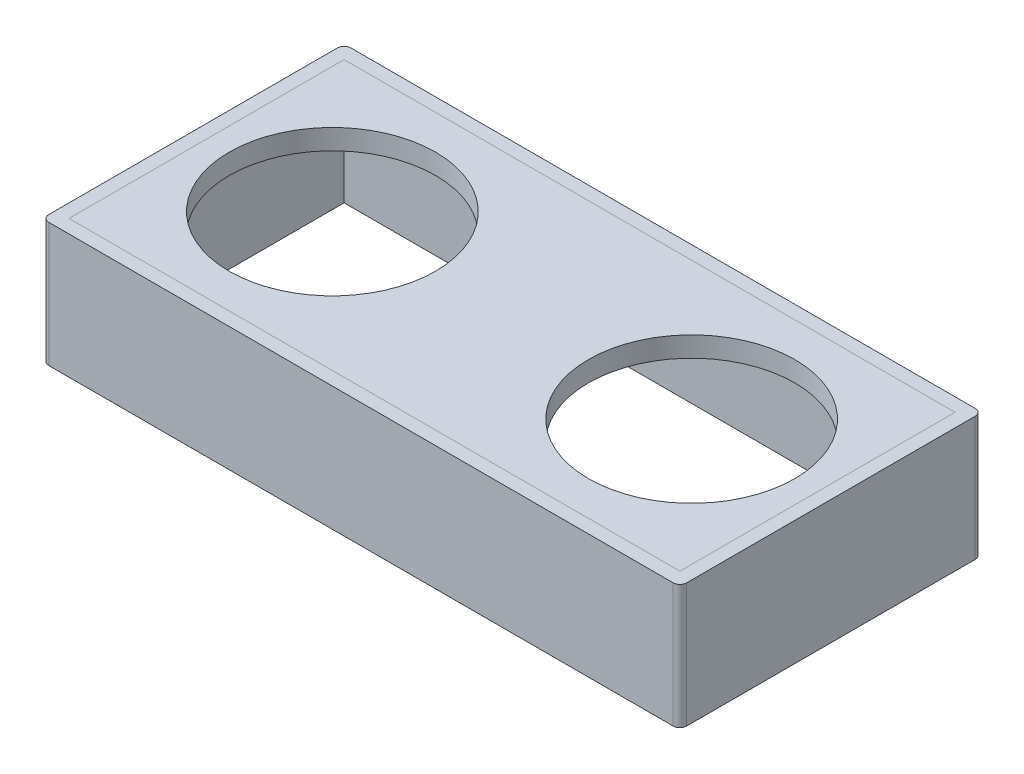
from build123d import *

# Parameters (mm, degrees)
CROQUIS2_W                   = 45.3
CROQUIS2_H                   = 20.4
CROQUIS2_R                   = 7.65
SALIENTE_EXTRUIR1_DEPTH      = 1.5
SALIENTE_EXTRUIR2_DEPTH      = 7.7
SALIENTE_EXTRUIR2_DEPTH_BACK = 1.5
CROQUIS3_W                   = 45.3
CROQUIS3_H                   = 20.4


with BuildPart() as part:
    # Croquis2 → Saliente-Extruir1 (new body)
    with BuildSketch(Plane(origin=(0, 0, 0), x_dir=(1, 0, 0), z_dir=(0, 1, 0))):
        with Locations((0.898083434, 0.47687702)):
            Rectangle(CROQUIS2_W, CROQUIS2_H)
        with Locations(Location((14.218083434, 0.47687702, 0), (0, 0, 270))):
            Circle(CROQUIS2_R, mode=Mode.SUBTRACT)
        with Locations(Location((-12.421916566, 0.47687702, 0), (0, 0, 270))):
            Circle(CROQUIS2_R, mode=Mode.SUBTRACT)
    extrude(amount=SALIENTE_EXTRUIR1_DEPTH)


with BuildPart() as body_2:
    # Croquis3 → Saliente-Extruir2 (new, two sides: drawn at the far end of the back side and taken through both)
    with BuildSketch(Plane.XZ.offset(-SALIENTE_EXTRUIR2_DEPTH_BACK)):
        with BuildLine():
            Line((-22.751916566, 10.22312298), (-22.751916566, -11.17687702))
            ThreePointArc((-22.751916566, -11.17687702), (-22.605469957, -11.530430411), (-22.251916566, -11.67687702))
            Line((-22.251916566, -11.67687702), (24.048083434, -11.67687702))
            ThreePointArc((24.048083434, -11.67687702), (24.401636824, -11.530430411), (24.548083434, -11.17687702))
            Line((24.548083434, -11.17687702), (24.548083434, 10.22312298))
            ThreePointArc((24.548083434, 10.22312298), (24.401636824, 10.57667637), (24.048083434, 10.72312298))
            Line((24.048083434, 10.72312298), (-22.251916566, 10.72312298))
            ThreePointArc((-22.251916566, 10.72312298), (-22.605469957, 10.57667637), (-22.751916566, 10.22312298))
        make_face()
        with Locations((0.898083434, -0.47687702)):
            Rectangle(CROQUIS3_W, CROQUIS3_H, mode=Mode.SUBTRACT)
    extrude(amount=SALIENTE_EXTRUIR2_DEPTH + SALIENTE_EXTRUIR2_DEPTH_BACK)


solid = Compound([part.part, body_2.part])
